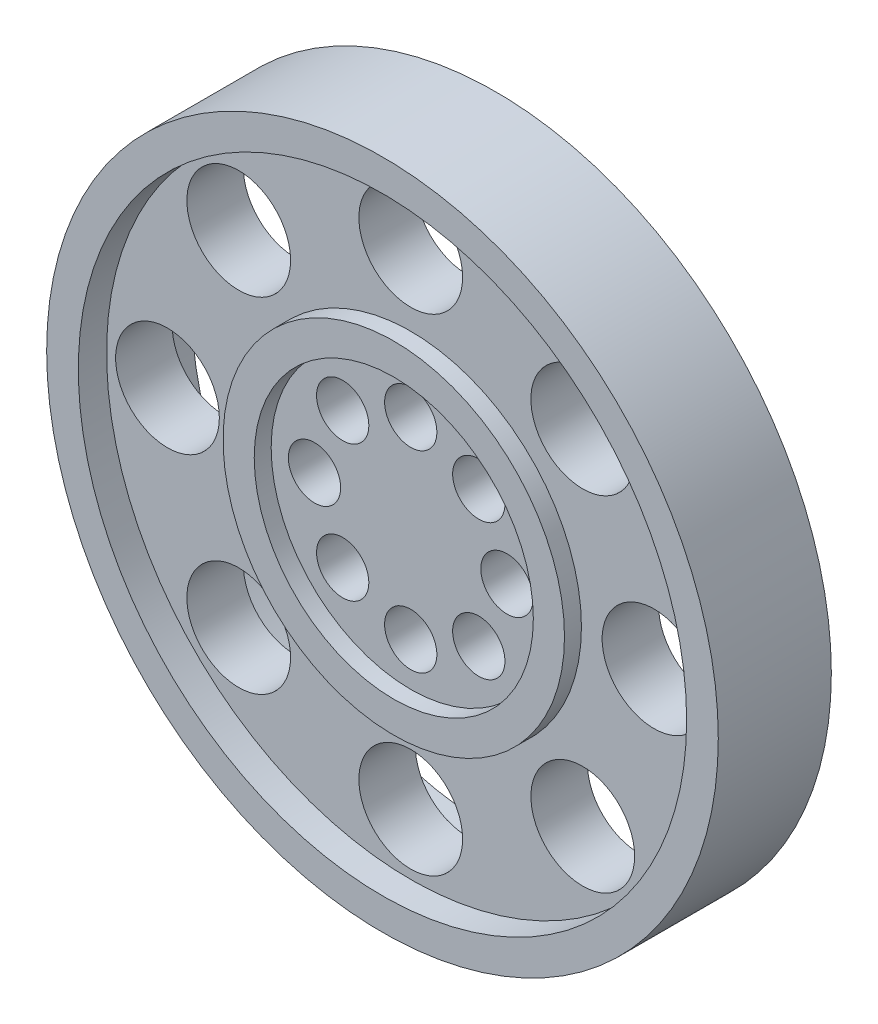
from build123d import *

# Parameters (mm, degrees)
SKETCH1_R           = 59.41
SKETCH1_R_2         = 53.81
BOSS_EXTRUDE1_DEPTH = 10
SKETCH1_3_R         = 53.81
SKETCH1_3_R_2       = 30.2
SKETCH1_3_R_3       = 9.175
SKETCH1_3_R_4       = 24.69
BOSS_EXTRUDE2_DEPTH = 5
SKETCH1_4_R         = 30.2
SKETCH1_4_R_2       = 24.69
BOSS_EXTRUDE3_DEPTH = 8
SKETCH1_5_R         = 4.625
SKETCH1_5_R_2       = 9.175
CUT_EXTRUDE1_DEPTH  = 85.611442489
CIRPATTERN2_COUNT   = 8


with BuildPart() as part:
    # Sketch1 → Boss-Extrude1 (new, symmetric)
    with BuildSketch(Plane.XY):
        Circle(SKETCH1_R)
        Circle(SKETCH1_R_2, mode=Mode.SUBTRACT)
    extrude(amount=BOSS_EXTRUDE1_DEPTH, both=True)

    # Sketch1<3> → Boss-Extrude2 (add, symmetric)
    # profile 1 of 2: a face of its own
    with BuildSketch(Plane.XY):
        Circle(SKETCH1_3_R)
        Circle(SKETCH1_3_R_2, mode=Mode.SUBTRACT)
        with Locations((0, 43.035)):
            Circle(SKETCH1_3_R_3, mode=Mode.SUBTRACT)
    # profile 2 of 2: a face of its own
    with BuildSketch(Plane.XY):
        Circle(SKETCH1_3_R_4)
    extrude(amount=BOSS_EXTRUDE2_DEPTH, both=True)


with BuildPart() as boss_extrude2_piece_1:
    # of the separate pieces the step leaves, piece 1, a body of its own (boss_extrude2_pieces)
    add(part.part.solids().sort_by_distance((59.41, 0, -10))[0])



with BuildPart() as boss_extrude2_piece_2:
    # of the separate pieces the step leaves, piece 2, a body of its own (boss_extrude2_pieces)
    add(part.part.solids().sort_by_distance((24.69, 0, -5))[0])


with BuildPart() as boss_extrude2_piece_1_1:
    add(boss_extrude2_piece_1.part)

    add(boss_extrude2_piece_2.part)  # Boss-Extrude3 merges Boss-Extrude2 piece 2
    # Sketch1<4> → Boss-Extrude3 (add, symmetric)
    with BuildSketch(Plane.XY):
        Circle(SKETCH1_4_R)
        Circle(SKETCH1_4_R_2, mode=Mode.SUBTRACT)
    extrude(amount=BOSS_EXTRUDE3_DEPTH, both=True)

    # Sketch1<5> → Cut-Extrude1 (cut, symmetric)
    with BuildSketch(Plane.XY):
        with Locations((0, 17.024057501)):
            Circle(SKETCH1_5_R)
        with Locations((0, 43.035)):
            Circle(SKETCH1_5_R_2)
    cut_extrude1 = extrude(amount=CUT_EXTRUDE1_DEPTH, both=True, mode=Mode.SUBTRACT)

    # CirPattern2: Cut-Extrude1 ×8 about axis
    cirpattern2_axis = Axis((0, 0, 8), (0, 0, 1))
    for i in range(1, CIRPATTERN2_COUNT):
        add(cut_extrude1.rotate(cirpattern2_axis, i * 360 / CIRPATTERN2_COUNT), mode=Mode.SUBTRACT)


solid = boss_extrude2_piece_1_1.part
